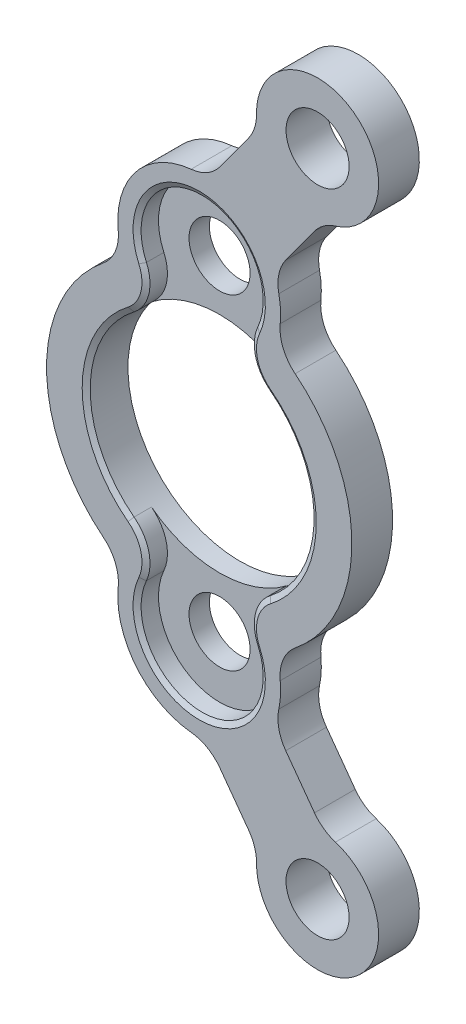
from build123d import *

# Parameters (mm, degrees)
SKETCH_1_R          = 3
SKETCH_1_R_2        = 1.55
EXTRUDE_1_DEPTH     = 2
EXTRUDE_1_2_DEPTH   = 2
SKETCH_1_R_3        = 5.5
SKETCH_1_R_4        = 1.5
EXTRUDE_1_3_DEPTH   = 2
EXTRUDE_2_DEPTH     = 2
SKETCH_3_R          = 3
CUT_EXTRUDE_1_DEPTH = 1
FILLET_2_R          = 2
CHAMFER_1_SIZE      = 0.25
CHAMFER_1_SIZE2     = 0.144337567


with BuildPart() as part:
    # ｽｹｯﾁ1 → ﾎﾞｽ - 押し出し1 (new body)
    with BuildSketch(Plane.XY):
        with Locations((5.814342437, 15.974774553)):
            Circle(SKETCH_1_R)
        with Locations((5.814342437, 15.974774553)):
            Circle(SKETCH_1_R_2, mode=Mode.SUBTRACT)
    extrude(amount=EXTRUDE_1_DEPTH)



with BuildPart() as body_2:
    # ｽｹｯﾁ1 → Extrude 1 2 (new body)
    with BuildSketch(Plane.XY):
        with Locations(Location((5.814342437, -15.974774553, 0), (0, 0, 180))):
            Circle(SKETCH_1_R)
        with Locations(Location((5.814342437, -15.974774553, 0), (0, 0, 180))):
            Circle(SKETCH_1_R_2, mode=Mode.SUBTRACT)
    extrude(amount=EXTRUDE_1_2_DEPTH)


with BuildPart() as body_3:
    # ｽｹｯﾁ1 → Extrude 1 3 (new body)
    with BuildSketch(Plane.XY):
        with BuildLine():
            ThreePointArc((3.714381625, -6.515625), (7.5, 0), (3.714381625, 6.515625))
            ThreePointArc((3.714381625, 6.515625), (0, 12), (-3.714381625, 6.515625))
            ThreePointArc((-3.714381625, 6.515625), (-7.5, 0), (-3.714381625, -6.515625))
            ThreePointArc((-3.714381625, -6.515625), (0, -12), (3.714381625, -6.515625))
        make_face()
        Circle(SKETCH_1_R_3, mode=Mode.SUBTRACT)
        with Locations((0, -8)):
            Circle(SKETCH_1_R_4, mode=Mode.SUBTRACT)
        with Locations(Location((0, 8, 0), (0, 0, 180))):
            Circle(SKETCH_1_R_4, mode=Mode.SUBTRACT)
    extrude(amount=EXTRUDE_1_3_DEPTH)


with BuildPart() as part_1:
    add(part.part)

    add(body_2.part)  # ﾎﾞｽ - 押し出し2 merges body 2

    add(body_3.part)  # ﾎﾞｽ - 押し出し2 merges body 3
    # ｽｹｯﾁ2 → ﾎﾞｽ - 押し出し2 (add, through all)
    with BuildSketch(Plane.XY.offset(2)):
        with BuildLine():
            Line((4.046944512, 13.550665526), (2.356530565, 11.23214537))
            ThreePointArc((2.356530565, 11.23214537), (3.112774512, 10.512097697), (3.65688802, 9.620854717))
            Line((3.65688802, 9.620854717), (6.113074488, 12.98968508))
            ThreePointArc((6.113074488, 12.98968508), (5.028263798, 13.079592284), (4.046944512, 13.550665526))
        make_face()
        with BuildLine():
            ThreePointArc((0.424742649, 11.977385282), (1.439692955, 11.731927678), (2.356530565, 11.23214537))
            Line((2.356530565, 11.23214537), (4.046944512, 13.550665526))
            ThreePointArc((4.046944512, 13.550665526), (3.2983125, 14.340885525), (2.880929118, 15.346215646))
            Line((2.880929118, 15.346215646), (0.424742649, 11.977385282))
        make_face()
        with BuildLine():
            ThreePointArc((3.65688802, -9.620854717), (2.356530565, -11.23214537), (0.424742649, -11.977385282))
            Line((0.424742649, -11.977385282), (2.880929118, -15.346215646))
            ThreePointArc((2.880929118, -15.346215646), (4.046944512, -13.550665526), (6.113074488, -12.98968508))
            Line((6.113074488, -12.98968508), (3.65688802, -9.620854717))
        make_face()
    extrude(amount=-EXTRUDE_2_DEPTH)

    # ｽｹｯﾁ3 → ｶｯﾄ - 押し出し1 (cut)
    with BuildSketch(Plane.XY.offset(2)):
        with Locations((0, 8)):
            Circle(SKETCH_3_R)
        with Locations((0, -8)):
            Circle(SKETCH_3_R)
    extrude(amount=-CUT_EXTRUDE_1_DEPTH, mode=Mode.SUBTRACT)

    # ﾌｨﾚｯﾄ2
    fillet_2_edges = [part_1.edges().sort_by_distance(p)[0] for p in [
        (2.880929118, 15.346215646, 1),
        (6.113074488, 12.98968508, 1),
        (3.65688802, 9.620854717, 1),
        (0.424742649, 11.977385282, 1),
        (2.880929118, -15.346215646, 1),
        (0.424742649, -11.977385282, 1),
        (3.65688802, -9.620854717, 1),
        (6.113074488, -12.98968508, 1),
        (-1.36421552, 5.328125, 1.5),
        (1.36421552, 5.328125, 1.5),
        (3.714381625, 6.515625, 1),
        (1.36421552, -5.328125, 1.5),
        (3.714381625, -6.515625, 1),
        (-1.36421552, -5.328125, 1.5),
        (-3.714381625, -6.515625, 1),
        (-3.714381625, 6.515625, 1),
    ]]
    fillet(fillet_2_edges, radius=FILLET_2_R)

    # 面取り1
    chamfer_1_edges = [part_1.edges().sort_by_distance(p)[0] for p in [
        (-2.622819565, 5.462987902, 2),
        (-2.622819565, -5.462987902, 2),
        (2.622819565, 5.462987902, 2),
        (2.622819565, -5.462987902, 2),
        (0, -11, 2),
        (4.932006961, 2.434195419, 2),
        (-5.5, 0, 2),
        (0, 11, 2),
    ]]
    chamfer_1_side = [part_1.faces().sort_by_distance(p)[0] for p in [
        (7.086923001, 0, 2),
    ]]
    chamfer(chamfer_1_edges, length=CHAMFER_1_SIZE, length2=CHAMFER_1_SIZE2, reference=chamfer_1_side[0])


solid = part_1.part
